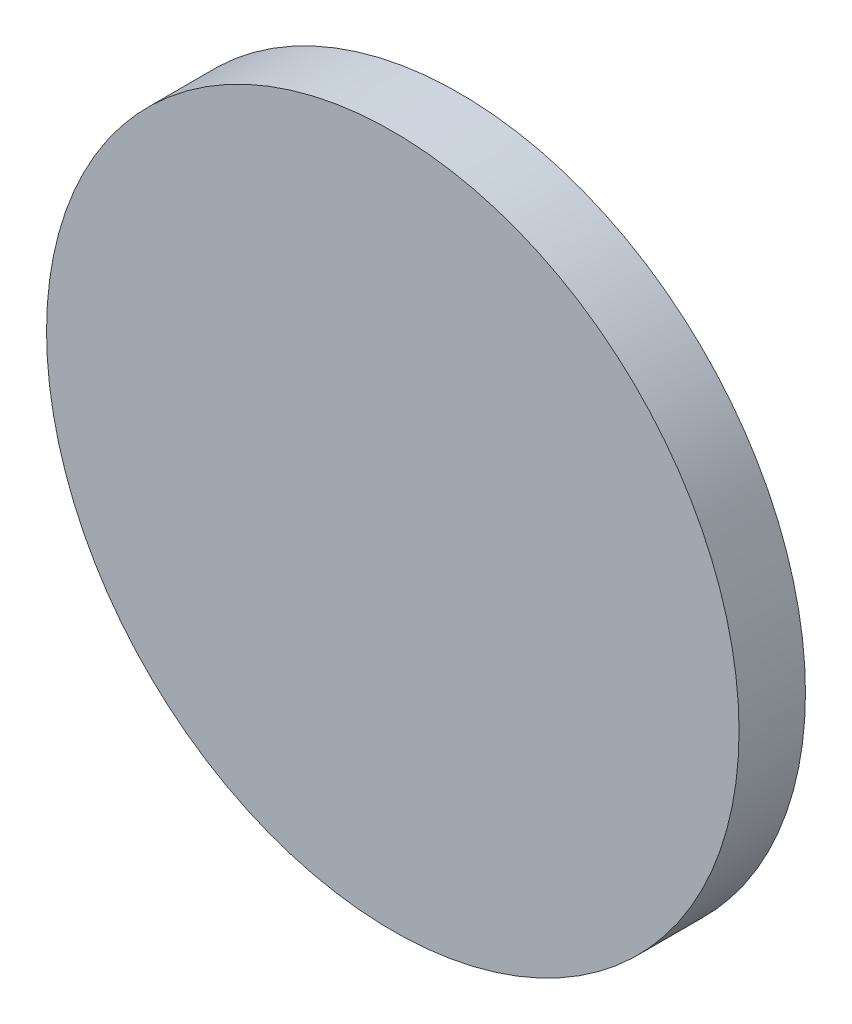
from build123d import *

# Parameters (mm, degrees)
SKETCH1_R           = 182.5
BOSS_EXTRUDE1_DEPTH = 35


with BuildPart() as part:
    # Sketch1 → Boss-Extrude1 (new body)
    with BuildSketch(Plane.XY):
        Circle(SKETCH1_R)
    extrude(amount=BOSS_EXTRUDE1_DEPTH)


solid = part.part
